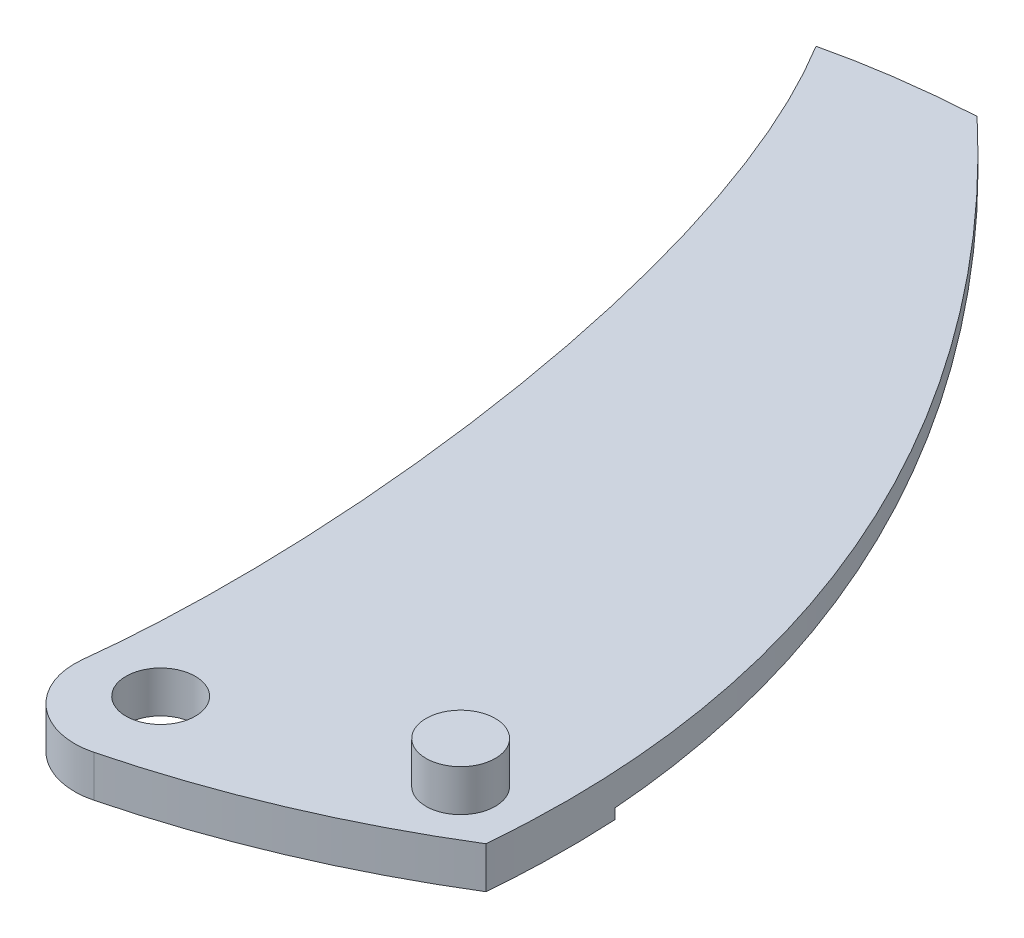
from build123d import *

# Parameters (mm, degrees)
EXTRUDE_2_DEPTH          = 3
SKETCH_6_R               = 2.5
CUT_EXTRUDE_3_DEPTH      = 3
FILLET_1_R               = 5
EXTRUDE_START            = 3
SKETCH_12_R              = 2.5
EXTRUDE_3_DEPTH          = 3
CUT_EXTRUDE_4_DEPTH      = 53.075400229
CUT_EXTRUDE_4_DEPTH_BACK = 53.075400229


with BuildPart() as part:
    # 草图5 → 凸台-拉伸2 (new body)
    with BuildSketch(Plane(origin=(0, 0, 0), x_dir=(1, 0, 0), z_dir=(0, 1, 0))):
        with BuildLine():
            ThreePointArc((10.559870576, -71.726836912), (50.703091685, -51.821293824), (71.479455105, -12.121777836))
            add(Edge.make_bspline(
                [(0, 0), (21.999765175, 5.26655471), (58.910704789, -3.551422078), (71.479455105, -12.121777836)],
                knots=[0, 0, 0, 0, 1, 1, 1, 1], degree=3))
            add(Edge.make_bspline(
                [(0, 0), (11.807092486, -19.295565119), (14.826805821, -57.124859445), (10.559870576, -71.726836912)],
                knots=[0, 0, 0, 0, 1, 1, 1, 1], degree=3))
        make_face()
    extrude(amount=EXTRUDE_2_DEPTH)

    # 草图6 → 切除-拉伸3 (cut)
    with BuildSketch(Plane(origin=(0, 0, 0), x_dir=(1, 0, 0), z_dir=(0, 1, 0))):
        with Locations(Location((16.980367579, -64.295545078, 0), (0, 0, 270))):
            Circle(SKETCH_6_R)
        with BuildLine():
            Line((10.193167245, 1.43451668), (79.733938156, 38.033041096))
            Line((79.733938156, 38.033041096), (67.619590309, -86.298423653))
            Line((67.619590309, -86.298423653), (37.943421347, -61.778206323))
            add(Edge.make_bspline(
                [(10.193167245, 1.43451668), (25.470457842, -12.985420951), (40.3134982, -34.977892419), (37.943421347, -61.778206323)],
                knots=[0, 0, 0, 0, 1, 1, 1, 1], degree=3))
        make_face()
    extrude(amount=CUT_EXTRUDE_3_DEPTH, mode=Mode.SUBTRACT)

    # 圆角1
    fillet_1_edges = [part.edges().sort_by_distance(p)[0] for p in [
        (10.559870576, 1.5, 71.726836912),
    ]]
    fillet(fillet_1_edges, radius=FILLET_1_R)

    # 草图12 → 凸台-拉伸3 (add)
    with BuildSketch(Plane(origin=(0, 0, 0), x_dir=(1, 0, 0), z_dir=(0, 1, 0)).offset(EXTRUDE_START)):
        with Locations(Location((33.447510377, -59.102789962, 0), (0, 0, 270))):
            Circle(SKETCH_12_R)
    extrude(amount=EXTRUDE_3_DEPTH)

    # 草图15 → 切除-拉伸4 (cut, two sides: drawn at the far end of the back side and taken through both)
    with BuildSketch(Plane(origin=(20.307849495, 0, 46.141092032), x_dir=(-0.3007418808113313, 0, -0.9537055736054305), z_dir=(0.9537055736054305, 0, -0.3007418808113313)).offset(-CUT_EXTRUDE_4_DEPTH_BACK)):
        Polygon((-11.510635463, 0.734616999), (50.112437496, 2.140825412), (51.673202283, 2.140825412), (51.673202283, -11.401301697), (-11.510635463, -3.981764366), align=None)
    extrude(amount=CUT_EXTRUDE_4_DEPTH + CUT_EXTRUDE_4_DEPTH_BACK, mode=Mode.SUBTRACT)


solid = part.part
